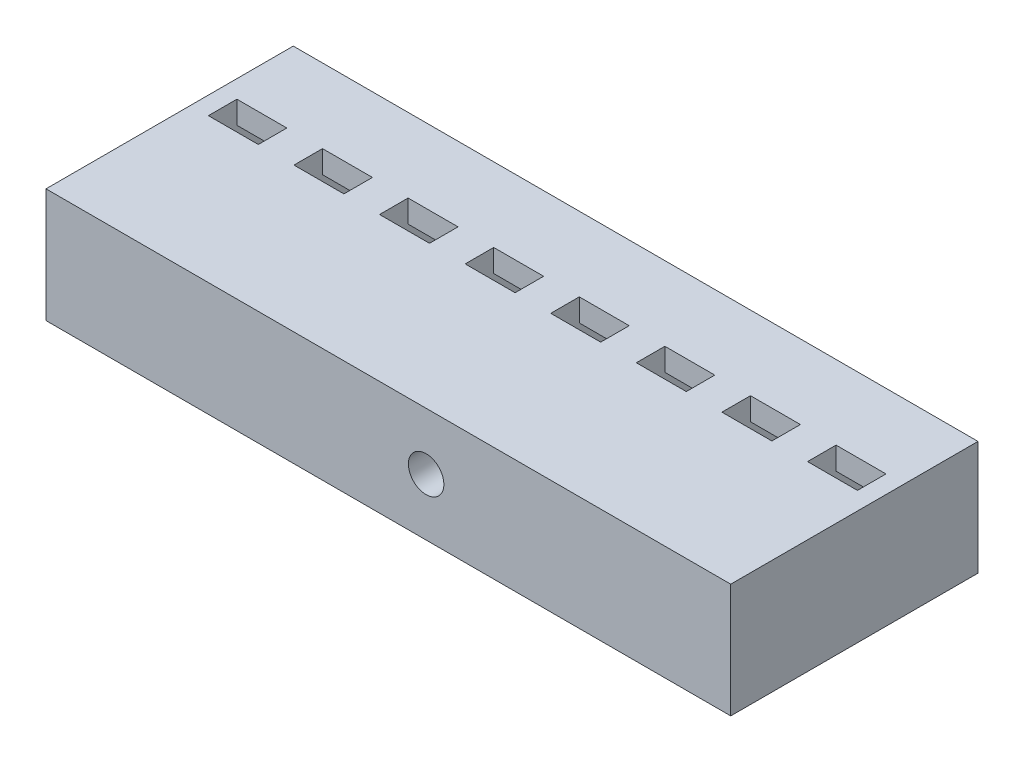
from build123d import *

# Parameters (mm, degrees)
SKETCH1_W           = 72
SKETCH1_H           = 22
BOSS_EXTRUDE1_DEPTH = 12
SKETCH2_W           = 5.25
SKETCH2_H           = 3
CUT_EXTRUDE1_DEPTH  = 77.23647421
LPATTERN2_COUNT     = 8
LPATTERN2_PITCH     = 9
SKETCH3_W           = 5.25
SKETCH3_H           = 7.25
CUT_EXTRUDE2_DEPTH  = 77.23647421
LPATTERN3_COUNT     = 8
LPATTERN3_PITCH     = 9
SKETCH4_W           = 72
SKETCH4_H           = 12
BOSS_EXTRUDE2_DEPTH = 4
SKETCH11_W          = 72
SKETCH11_H          = 12
BOSS_EXTRUDE3_DEPTH = 4
SKETCH12_R          = 1.865
CUT_EXTRUDE9_DEPTH  = 6


with BuildPart() as part:
    # Sketch1 → Boss-Extrude1 (new body)
    with BuildSketch(Plane(origin=(0, 0, 0), x_dir=(1, 0, 0), z_dir=(0, 1, 0))):
        with Locations((-36, 11)):
            Rectangle(SKETCH1_W, SKETCH1_H)
    extrude(amount=BOSS_EXTRUDE1_DEPTH)

    # Sketch2 → Cut-Extrude1 (cut, through all)
    with BuildSketch(Plane(origin=(0, 12, 0), x_dir=(1, 0, 0), z_dir=(0, 1, 0))):
        with Locations((-67.5, 12.7)):
            Rectangle(SKETCH2_W, SKETCH2_H)
    cut_extrude1 = extrude(amount=-CUT_EXTRUDE1_DEPTH, mode=Mode.SUBTRACT)

    # LPattern2: Cut-Extrude1 ×8
    with Locations(*[(i * LPATTERN2_PITCH, 0, 0) for i in range(1, LPATTERN2_COUNT)]):
        add(cut_extrude1, mode=Mode.SUBTRACT)

    # Sketch3 → Cut-Extrude2 (cut, through all)
    with BuildSketch(Plane(origin=(0, 0, -22), x_dir=(-1, 0, 0), z_dir=(0, 0, -1))):
        with Locations((67.5, 6)):
            Rectangle(SKETCH3_W, SKETCH3_H)
    cut_extrude2 = extrude(amount=-CUT_EXTRUDE2_DEPTH, mode=Mode.SUBTRACT)

    # LPattern3: Cut-Extrude2 ×8
    with Locations(*[(i * LPATTERN3_PITCH, 0, 0) for i in range(1, LPATTERN3_COUNT)]):
        add(cut_extrude2, mode=Mode.SUBTRACT)

    # Sketch4 → Boss-Extrude2 (add)
    with BuildSketch(Plane.XY):
        with Locations((-36, 6)):
            Rectangle(SKETCH4_W, SKETCH4_H)
    extrude(amount=-BOSS_EXTRUDE2_DEPTH)

    # Sketch11 → Boss-Extrude3 (add)
    with BuildSketch(Plane.XY):
        with Locations((-36, 6)):
            Rectangle(SKETCH11_W, SKETCH11_H)
    extrude(amount=BOSS_EXTRUDE3_DEPTH)

    # Sketch12 → Cut-Extrude9 (cut)
    with BuildSketch(Plane.XY.offset(4)):
        with Locations((-32.03, 6)):
            Circle(SKETCH12_R)
    extrude(amount=-CUT_EXTRUDE9_DEPTH, mode=Mode.SUBTRACT)


solid = part.part
